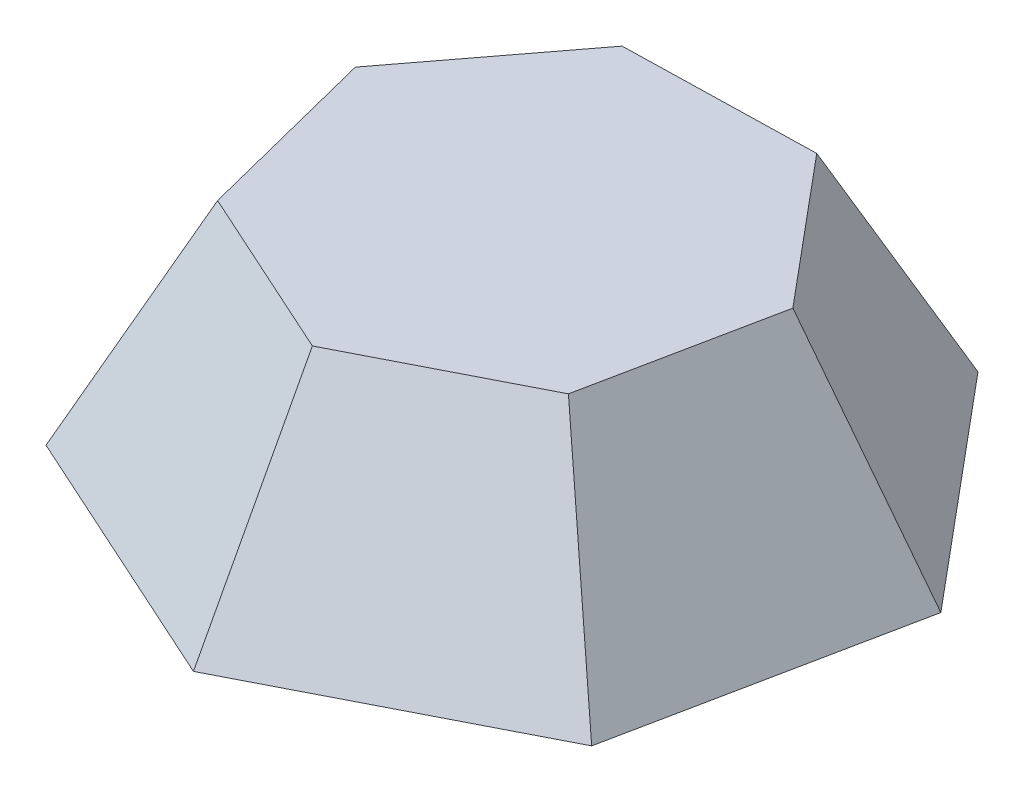
from build123d import *

# Parameters (mm, degrees)
SKETCH3_R          = 1.5
CUT_EXTRUDE1_DEPTH = 7


with BuildPart() as part:
    # Sketch2 → Loft1 section 0
    with BuildSketch(Plane(origin=(0, -10, 0), x_dir=(1, 0, 0), z_dir=(0, 1, 0))):
        with BuildLine():
            Line((6.413648207, 14.153454805), (-7.066772303, 13.838926817))
            Line((-7.066772303, 13.838926817), (-15.225769132, 3.103404673))
            Line((-15.225769132, 3.103404673), (-11.919451256, -9.969044488))
            Line((-11.919451256, -9.969044488), (0.362456529, -15.534599818))
            Line((0.362456529, -15.534599818), (12.371427154, -9.402284637))
            Line((12.371427154, -9.402284637), (15.064460802, 3.810142647))
            Line((15.064460802, 3.810142647), (6.413648207, 14.153454805))
        make_face()
    # Sketch1 → Loft1 section 1
    with BuildSketch(Plane(origin=(0, 0, 0), x_dir=(1, 0, 0), z_dir=(0, 1, 0))):
        with BuildLine():
            Line((7.953060314, -6.044325838), (9.68429623, 2.449377416))
            Line((9.68429623, 2.449377416), (4.123059561, 9.098649518))
            Line((4.123059561, 9.098649518), (-4.542925052, 8.896452954))
            Line((-4.542925052, 8.896452954), (-9.787994442, 1.995045862))
            Line((-9.787994442, 1.995045862), (-7.662504379, -6.408671456))
            Line((-7.662504379, -6.408671456), (0.233007768, -9.986528454))
            Line((0.233007768, -9.986528454), (7.953060314, -6.044325838))
        make_face()
    loft()

    # Sketch3 → Cut-Extrude1 (cut)
    with BuildSketch(Plane.XZ.offset(10)):
        with Locations(Location((0, 0, 0), (0, 0, 270))):
            Circle(SKETCH3_R)
    extrude(amount=-CUT_EXTRUDE1_DEPTH, mode=Mode.SUBTRACT)


solid = part.part
